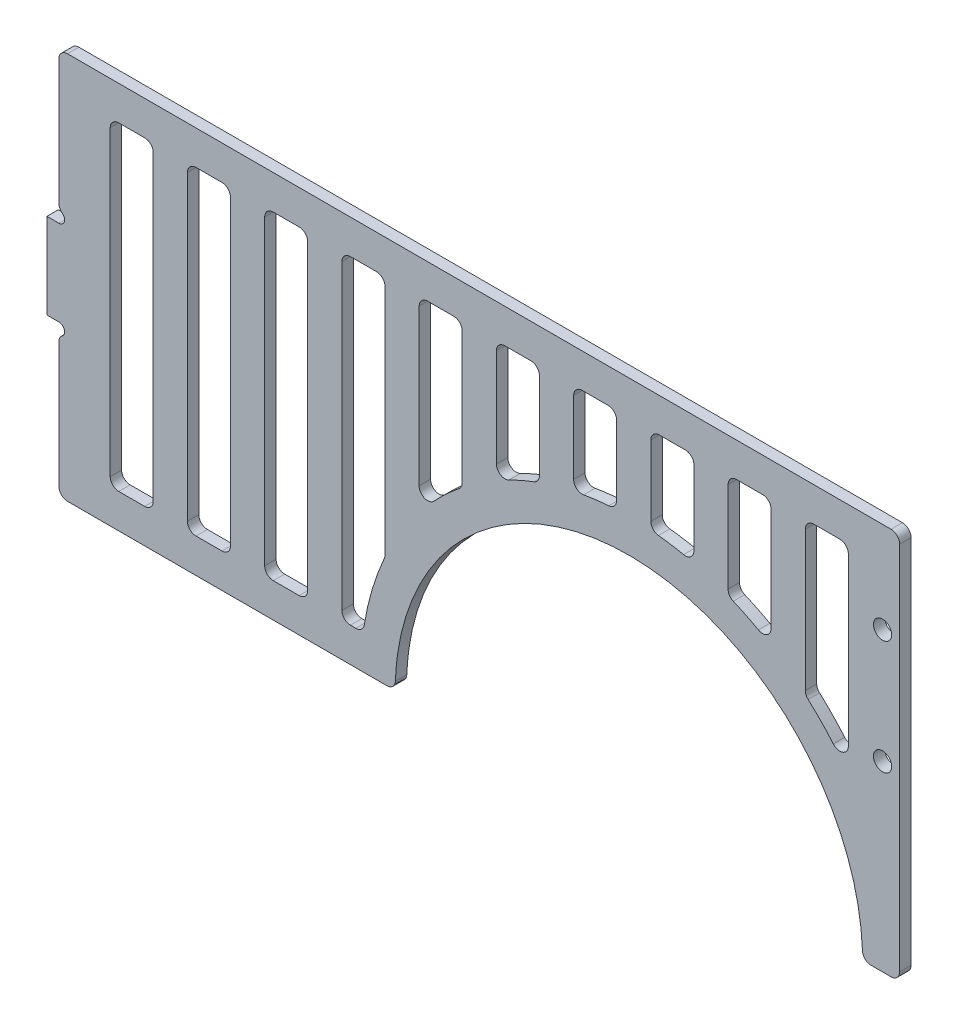
from build123d import *

# Parameters (mm, degrees)
SKETCH_1_W          = 147.5
SKETCH_1_H          = 68
EXTRUDE_1_DEPTH     = 2
SKETCH_2_W          = 2.1
SKETCH_2_H          = 15
EXTRUDE_2_DEPTH     = 2
SKETCH_3_R          = 1
CUT_EXTRUDE_1_DEPTH = 10
SKETCH_4_R          = 41
CUT_EXTRUDE_2_DEPTH = 86.383343966
SKETCH_5_W          = 7.55
SKETCH_5_H          = 56
CUT_EXTRUDE_3_DEPTH = 10
FILLET_1_R          = 1.5
SKETCH_6_R          = 1.6
CUT_EXTRUDE_4_DEPTH = 84.145790768


with BuildPart() as part:
    # 草图1 → 凸台-拉伸1 (new body)
    with BuildSketch(Plane.XY):
        Rectangle(SKETCH_1_W, SKETCH_1_H)
    extrude(amount=EXTRUDE_1_DEPTH)

    # 草图2 → 凸台-拉伸2 (add)
    with BuildSketch(Plane.XY.offset(2)):
        with Locations((-74.8, 0)):
            Rectangle(SKETCH_2_W, SKETCH_2_H)
    extrude(amount=-EXTRUDE_2_DEPTH)

    # 草图3 → 切除-拉伸1 (cut)
    with BuildSketch(Plane.XY.offset(2)):
        with Locations((-73.75, 8.5)):
            Circle(SKETCH_3_R)
        with Locations((-73.75, -8.5)):
            Circle(SKETCH_3_R)
    extrude(amount=-CUT_EXTRUDE_1_DEPTH, mode=Mode.SUBTRACT)

    # 草图4 → 切除-拉伸2 (cut, through all)
    with BuildSketch(Plane(origin=(0, -1.238963971, -15.184537967), x_dir=(-1, 0, 0), z_dir=(0, -0.08132352941176414, -0.9966877563028524))):
        with Locations((-26.25, -34.112616286)):
            Circle(SKETCH_4_R)
    extrude(amount=-CUT_EXTRUDE_2_DEPTH, mode=Mode.SUBTRACT)

    # 草图5 → 切除-拉伸3 (cut)
    with BuildSketch(Plane.XY.offset(2)):
        with BuildLine():
            ThreePointArc((57.2, 1.30806357), (61.228827839, -2.670411735), (64.75, -7.104491812))
            Line((64.75, -7.104491812), (64.75, 28))
            Line((64.75, 28), (57.2, 28))
            Line((57.2, 28), (57.2, 1.30806357))
        make_face()
        with BuildLine():
            ThreePointArc((43.65, 9.597715314), (47.51140105, 7.853227963), (51.2, 5.768068026))
            Line((51.2, 5.768068026), (51.2, 28))
            Line((51.2, 28), (43.65, 28))
            Line((43.65, 28), (43.65, 9.597715314))
        make_face()
        with BuildLine():
            ThreePointArc((30.1, 12.779255237), (33.900390726, 12.310383571), (37.65, 11.533697921))
            Line((37.65, 11.533697921), (37.65, 28))
            Line((37.65, 28), (30.1, 28))
            Line((30.1, 28), (30.1, 12.779255237))
        make_face()
        with BuildLine():
            ThreePointArc((16.55, 11.925357473), (20.3054817, 12.559762544), (24.1, 12.888005534))
            Line((24.1, 12.888005534), (24.1, 28))
            Line((24.1, 28), (16.55, 28))
            Line((16.55, 28), (16.55, 11.925357473))
        make_face()
        with BuildLine():
            Line((3, 28), (3, 6.783718345))
            ThreePointArc((3, 6.783718345), (6.698589297, 8.677613253), (10.55, 10.23743257))
            Line((10.55, 10.23743257), (10.55, 28))
            Line((10.55, 28), (3, 28))
        make_face()
        with BuildLine():
            Line((-10.55, 28), (-10.55, -4.826514156))
            ThreePointArc((-10.55, -4.826514156), (-6.990214832, -0.834971606), (-3, 2.726301758))
            Line((-3, 2.726301758), (-3, 28))
            Line((-3, 28), (-10.55, 28))
        make_face()
        with BuildLine():
            Line((-24.1, -28), (-20.357323082, -28))
            ThreePointArc((-20.357323082, -28), (-18.949835838, -21.179670039), (-16.55, -14.642185119))
            Line((-16.55, -14.642185119), (-16.55, 28))
            Line((-16.55, 28), (-24.1, 28))
            Line((-24.1, 28), (-24.1, -28))
        make_face()
        with Locations((-33.875, 0)):
            Rectangle(SKETCH_5_W, SKETCH_5_H)
        with Locations((-47.425, 0)):
            Rectangle(SKETCH_5_W, SKETCH_5_H)
        with Locations((-60.975, 0)):
            Rectangle(SKETCH_5_W, SKETCH_5_H)
    extrude(amount=-CUT_EXTRUDE_3_DEPTH, mode=Mode.SUBTRACT)

    # 圆角1
    fillet_1_edges = [part.edges().sort_by_distance(p)[0] for p in [
        (-14.749747441, -34, 0.999999977),
        (67.249747441, -34, 0.999999977),
        (-73.75, -34, 1),
        (-73.75, -9.5, 1),
        (-73.75, 9.5, 1),
        (-73.75, 34, 1),
        (73.75, 34, 1),
        (73.75, -34, 1),
        (57.2, 1.30806357, 1),
        (57.2, 28, 1),
        (64.75, 28, 1),
        (30.1, 12.779255237, 1),
        (30.1, 28, 1),
        (37.65, 28, 1),
        (37.65, 11.533697921, 1),
        (3, 6.783718345, 1),
        (3, 28, 1),
        (10.55, 28, 1),
        (10.55, 10.23743257, 1),
        (-20.357323082, -28, 1),
        (-24.1, -28, 1),
        (-24.1, 28, 1),
        (-16.55, 28, 1),
        (-16.55, -14.642185119, 1),
        (-51.2, -28, 1),
        (-51.2, 28, 1),
        (-43.65, 28, 1),
        (-43.65, -28, 1),
        (-64.75, 28, 1),
        (-57.2, 28, 1),
        (-57.2, -28, 1),
        (-64.75, -28, 1),
        (-37.65, -28, 1),
        (-37.65, 28, 1),
        (-30.1, 28, 1),
        (-30.1, -28, 1),
        (-10.55, -4.826514156, 1),
        (-10.55, 28, 1),
        (-3, 28, 1),
        (-3, 2.726301758, 1),
        (16.55, 11.925357473, 1),
        (16.55, 28, 1),
        (24.1, 28, 1),
        (24.1, 12.888005534, 1),
        (43.65, 9.597715314, 1),
        (43.65, 28, 1),
        (51.2, 28, 1),
        (51.2, 5.768068026, 1),
        (64.75, -7.104491812, 1),
    ]]
    fillet(fillet_1_edges, radius=FILLET_1_R)

    # 草图6 → 切除-拉伸4 (cut, through all)
    with BuildSketch(Plane.XY.offset(2)):
        with Locations((70.75, -2)):
            Circle(SKETCH_6_R)
        with Locations((70.75, 18)):
            Circle(SKETCH_6_R)
    extrude(amount=-CUT_EXTRUDE_4_DEPTH, mode=Mode.SUBTRACT)


solid = part.part
